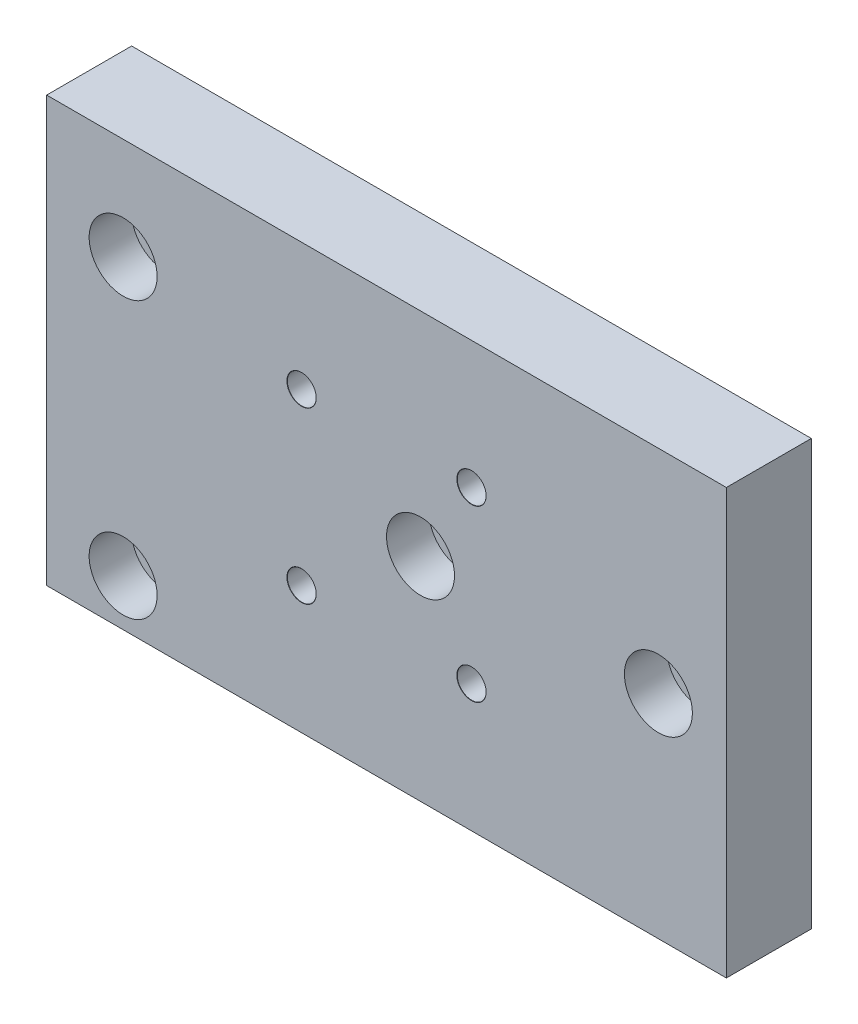
from build123d import *

# Parameters (mm, degrees)
SKETCH_1_W                   = 80
SKETCH_1_H                   = 50
EXTRUDE_1_DEPTH              = 10
SKETCH_5_R                   = 1.75
CUT_EXTRUDE_1_DEPTH          = 49.218253805
SKETCH_6_R                   = 4
CUT_EXTRUDE_2_DEPTH          = 5
HOLE_WIZARD_M3_1_D           = 3.4
HOLE_WIZARD_M3_1_CSINK_D     = 3.45
HOLE_WIZARD_M3_1_CSINK_ANGLE = 90


with BuildPart() as part:
    # 草图1 → 凸台-拉伸1 (new body)
    with BuildSketch(Plane.XY):
        Rectangle(SKETCH_1_W, SKETCH_1_H)
    extrude(amount=EXTRUDE_1_DEPTH)

    # 草图5 → 切除-拉伸1 (cut, through all)
    with BuildSketch(Plane(origin=(0, 0, 0), x_dir=(-1, 0, 0), z_dir=(0, 0, -1))):
        with Locations((-32, 0)):
            Circle(SKETCH_5_R)
        with Locations((-4, 0)):
            Circle(SKETCH_5_R)
        with Locations((31, 13)):
            Circle(SKETCH_5_R)
        with Locations((31, -19.5)):
            Circle(SKETCH_5_R)
    extrude(amount=-CUT_EXTRUDE_1_DEPTH, mode=Mode.SUBTRACT)

    # 草图6 → 切除-拉伸2 (cut)
    with BuildSketch(Plane.XY.offset(10)):
        with Locations((-31, 13)):
            Circle(SKETCH_6_R)
        with Locations((4, 0)):
            Circle(SKETCH_6_R)
        with Locations((32, 0)):
            Circle(SKETCH_6_R)
        with Locations((-31, -19.5)):
            Circle(SKETCH_6_R)
    extrude(amount=-CUT_EXTRUDE_2_DEPTH, mode=Mode.SUBTRACT)

    # M3 间隙孔1 (through all)
    with Locations(Plane.XY.offset(10)):
        with Locations((-10, 10), (10, 10), (10, -10), (-10, -10)):
            CounterSinkHole(HOLE_WIZARD_M3_1_D / 2, HOLE_WIZARD_M3_1_CSINK_D / 2, counter_sink_angle=HOLE_WIZARD_M3_1_CSINK_ANGLE)


solid = part.part
